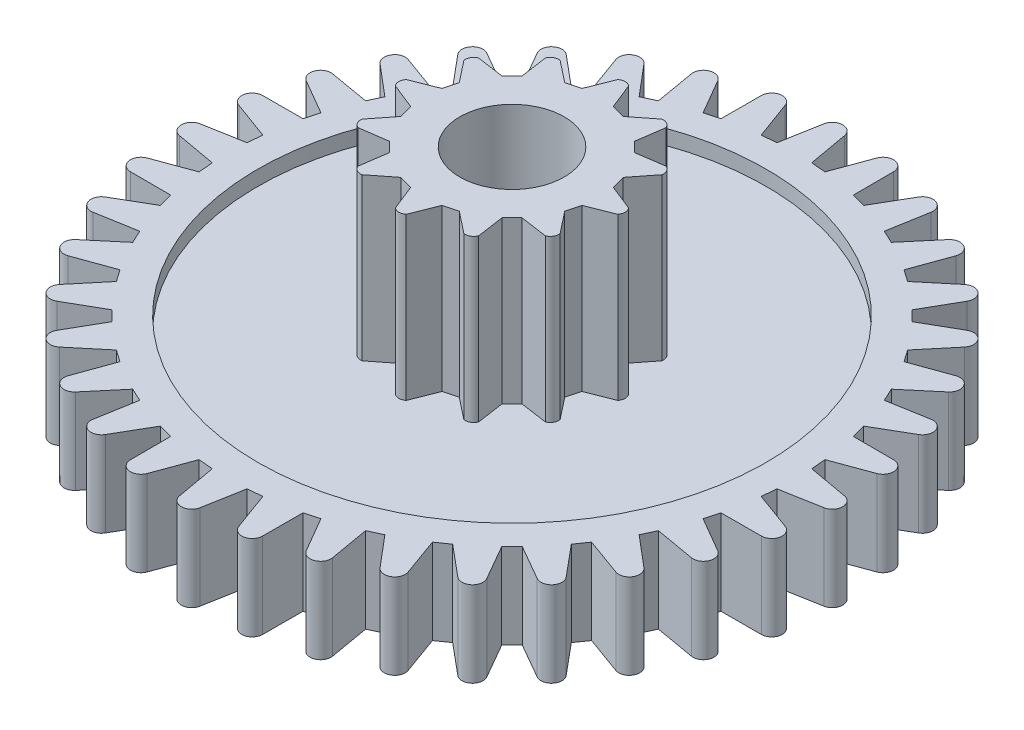
from build123d import *

# Parameters (mm, degrees)
SKETCH2_R          = 13.435028843
CUT_EXTRUDE1_DEPTH = 2.45
SKETCH3_R          = 4.596194078
CUT_EXTRUDE2_DEPTH = 4.63


with BuildPart() as part:
    # Sketch1 → Revolve1 (revolve)
    with BuildSketch(Plane.XY, mode=Mode.PRIVATE) as revolve1_sk:
        Polygon((3.25, 0.795), (7.3, 0.795), (7.3, 1.225), (9.5, 1.225), (9.5, -1.225), (7.3, -1.225), (7.3, -0.795), (2.5, -0.795), (2.5, -1.225), (1.5, -1.225), (1.5, 5.425), (3.25, 5.425), align=None)
    revolve(revolve1_sk.sketch.rotate(Axis((0, 5.425, 0), (0, -1, 0)), 90), axis=Axis((0, 5.425, 0), (0, -1, 0)))

    # Sketch2 → Cut-Extrude1 (cut)
    with BuildSketch(Plane(origin=(0, 1.225, 0), x_dir=(1, 0, 0), z_dir=(0, 1, 0))):
        Circle(SKETCH2_R)
        with BuildLine():
            Line((-0.295304093, 9.252872421), (-0.5, 8.109600792))
            Line((-0.5, 8.109600792), (-0.915813523, 8.073221822))
            Line((-0.915813523, 8.073221822), (-1.315926674, 9.163579516))
            ThreePointArc((-1.315926674, 9.163579516), (-1.649657688, 9.355673654), (-1.897562194, 9.061021481))
            Line((-1.897562194, 9.061021481), (-1.900621276, 7.899573645))
            Line((-1.900621276, 7.899573645), (-2.303800515, 7.791542093))
            Line((-2.303800515, 7.791542093), (-2.887173675, 8.795855883))
            ThreePointArc((-2.887173675, 8.795855883), (-3.249191362, 8.927079897), (-3.442163828, 8.593855987))
            Line((-3.442163828, 8.593855987), (-3.243493135, 7.44952195))
            Line((-3.243493135, 7.44952195), (-3.621787694, 7.2731203))
            Line((-3.621787694, 7.2731203), (-4.370695365, 8.160874621))
            ThreePointArc((-4.370695365, 8.160874621), (-4.75, 8.227241336), (-4.882177057, 7.865570529))
            Line((-4.882177057, 7.865570529), (-4.487813098, 6.7731203))
            Line((-4.487813098, 6.7731203), (-4.829728687, 6.533708427))
            Line((-4.829728687, 6.533708427), (-5.721415687, 7.277929313))
            ThreePointArc((-5.721415687, 7.277929313), (-6.106482292, 7.27742221), (-6.173847806, 6.898293689))
            Line((-6.173847806, 6.898293689), (-5.59577313, 5.890920818))
            Line((-5.59577313, 5.890920818), (-5.890920818, 5.59577313))
            Line((-5.890920818, 5.59577313), (-6.898293689, 6.173847806))
            ThreePointArc((-6.898293689, 6.173847806), (-7.27742221, 6.106482292), (-7.277929313, 5.721415687))
            Line((-7.277929313, 5.721415687), (-6.533708427, 4.829728687))
            Line((-6.533708427, 4.829728687), (-6.7731203, 4.487813098))
            Line((-6.7731203, 4.487813098), (-7.865570529, 4.882177057))
            ThreePointArc((-7.865570529, 4.882177057), (-8.227241336, 4.75), (-8.160874621, 4.370695365))
            Line((-8.160874621, 4.370695365), (-7.2731203, 3.621787694))
            Line((-7.2731203, 3.621787694), (-7.44952195, 3.243493135))
            Line((-7.44952195, 3.243493135), (-8.593855987, 3.442163828))
            ThreePointArc((-8.593855987, 3.442163828), (-8.927079897, 3.249191362), (-8.795855883, 2.887173675))
            Line((-8.795855883, 2.887173675), (-7.791542093, 2.303800515))
            Line((-7.791542093, 2.303800515), (-7.899573645, 1.900621276))
            Line((-7.899573645, 1.900621276), (-9.061021481, 1.897562194))
            ThreePointArc((-9.061021481, 1.897562194), (-9.355673654, 1.649657688), (-9.163579516, 1.315926674))
            Line((-9.163579516, 1.315926674), (-8.073221822, 0.915813523))
            Line((-8.073221822, 0.915813523), (-8.109600792, 0.5))
            Line((-8.109600792, 0.5), (-9.252872421, 0.295304093))
            ThreePointArc((-9.252872421, 0.295304093), (-9.5, 0), (-9.252872421, -0.295304093))
            Line((-9.252872421, -0.295304093), (-8.109600792, -0.5))
            Line((-8.109600792, -0.5), (-8.073221822, -0.915813523))
            Line((-8.073221822, -0.915813523), (-9.163579516, -1.315926674))
            ThreePointArc((-9.163579516, -1.315926674), (-9.355673654, -1.649657688), (-9.061021481, -1.897562194))
            Line((-9.061021481, -1.897562194), (-7.899573645, -1.900621276))
            Line((-7.899573645, -1.900621276), (-7.791542093, -2.303800515))
            Line((-7.791542093, -2.303800515), (-8.795855883, -2.887173675))
            ThreePointArc((-8.795855883, -2.887173675), (-8.927079897, -3.249191362), (-8.593855987, -3.442163828))
            Line((-8.593855987, -3.442163828), (-7.44952195, -3.243493135))
            Line((-7.44952195, -3.243493135), (-7.2731203, -3.621787694))
            Line((-7.2731203, -3.621787694), (-8.160874621, -4.370695365))
            ThreePointArc((-8.160874621, -4.370695365), (-8.227241336, -4.75), (-7.865570529, -4.882177057))
            Line((-7.865570529, -4.882177057), (-6.7731203, -4.487813098))
            Line((-6.7731203, -4.487813098), (-6.533708427, -4.829728687))
            Line((-6.533708427, -4.829728687), (-7.277929313, -5.721415687))
            ThreePointArc((-7.277929313, -5.721415687), (-7.27742221, -6.106482292), (-6.898293689, -6.173847806))
            Line((-6.898293689, -6.173847806), (-5.890920818, -5.59577313))
            Line((-5.890920818, -5.59577313), (-5.59577313, -5.890920818))
            Line((-5.59577313, -5.890920818), (-6.173847806, -6.898293689))
            ThreePointArc((-6.173847806, -6.898293689), (-6.106482292, -7.27742221), (-5.721415687, -7.277929313))
            Line((-5.721415687, -7.277929313), (-4.829728687, -6.533708427))
            Line((-4.829728687, -6.533708427), (-4.487813098, -6.7731203))
            Line((-4.487813098, -6.7731203), (-4.882177057, -7.865570529))
            ThreePointArc((-4.882177057, -7.865570529), (-4.75, -8.227241336), (-4.370695365, -8.160874621))
            Line((-4.370695365, -8.160874621), (-3.621787694, -7.2731203))
            Line((-3.621787694, -7.2731203), (-3.243493135, -7.44952195))
            Line((-3.243493135, -7.44952195), (-3.442163828, -8.593855987))
            ThreePointArc((-3.442163828, -8.593855987), (-3.249191362, -8.927079897), (-2.887173675, -8.795855883))
            Line((-2.887173675, -8.795855883), (-2.303800515, -7.791542093))
            Line((-2.303800515, -7.791542093), (-1.900621276, -7.899573645))
            Line((-1.900621276, -7.899573645), (-1.897562194, -9.061021481))
            ThreePointArc((-1.897562194, -9.061021481), (-1.649657688, -9.355673654), (-1.315926674, -9.163579516))
            Line((-1.315926674, -9.163579516), (-0.915813523, -8.073221822))
            Line((-0.915813523, -8.073221822), (-0.5, -8.109600792))
            Line((-0.5, -8.109600792), (-0.295304093, -9.252872421))
            ThreePointArc((-0.295304093, -9.252872421), (0, -9.5), (0.295304093, -9.252872421))
            Line((0.295304093, -9.252872421), (0.5, -8.109600792))
            Line((0.5, -8.109600792), (0.915813523, -8.073221822))
            Line((0.915813523, -8.073221822), (1.315926674, -9.163579516))
            ThreePointArc((1.315926674, -9.163579516), (1.649657688, -9.355673654), (1.897562194, -9.061021481))
            Line((1.897562194, -9.061021481), (1.900621276, -7.899573645))
            Line((1.900621276, -7.899573645), (2.303800515, -7.791542093))
            Line((2.303800515, -7.791542093), (2.887173675, -8.795855883))
            ThreePointArc((2.887173675, -8.795855883), (3.249191362, -8.927079897), (3.442163828, -8.593855987))
            Line((3.442163828, -8.593855987), (3.243493135, -7.44952195))
            Line((3.243493135, -7.44952195), (3.621787694, -7.2731203))
            Line((3.621787694, -7.2731203), (4.370695365, -8.160874621))
            ThreePointArc((4.370695365, -8.160874621), (4.75, -8.227241336), (4.882177057, -7.865570529))
            Line((4.882177057, -7.865570529), (4.487813098, -6.7731203))
            Line((4.487813098, -6.7731203), (4.829728687, -6.533708427))
            Line((4.829728687, -6.533708427), (5.721415687, -7.277929313))
            ThreePointArc((5.721415687, -7.277929313), (6.106482292, -7.27742221), (6.173847806, -6.898293689))
            Line((6.173847806, -6.898293689), (5.59577313, -5.890920818))
            Line((5.59577313, -5.890920818), (5.890920818, -5.59577313))
            Line((5.890920818, -5.59577313), (6.898293689, -6.173847806))
            ThreePointArc((6.898293689, -6.173847806), (7.27742221, -6.106482292), (7.277929313, -5.721415687))
            Line((7.277929313, -5.721415687), (6.533708427, -4.829728687))
            Line((6.533708427, -4.829728687), (6.7731203, -4.487813098))
            Line((6.7731203, -4.487813098), (7.865570529, -4.882177057))
            ThreePointArc((7.865570529, -4.882177057), (8.227241336, -4.75), (8.160874621, -4.370695365))
            Line((8.160874621, -4.370695365), (7.2731203, -3.621787694))
            Line((7.2731203, -3.621787694), (7.44952195, -3.243493135))
            Line((7.44952195, -3.243493135), (8.593855987, -3.442163828))
            ThreePointArc((8.593855987, -3.442163828), (8.927079897, -3.249191362), (8.795855883, -2.887173675))
            Line((8.795855883, -2.887173675), (7.791542093, -2.303800515))
            Line((7.791542093, -2.303800515), (7.899573645, -1.900621276))
            Line((7.899573645, -1.900621276), (9.061021481, -1.897562194))
            ThreePointArc((9.061021481, -1.897562194), (9.355673654, -1.649657688), (9.163579516, -1.315926674))
            Line((9.163579516, -1.315926674), (8.073221822, -0.915813523))
            Line((8.073221822, -0.915813523), (8.109600792, -0.5))
            Line((8.109600792, -0.5), (9.252872421, -0.295304093))
            ThreePointArc((9.252872421, -0.295304093), (9.5, 0), (9.252872421, 0.295304093))
            Line((9.252872421, 0.295304093), (8.109600792, 0.5))
            Line((8.109600792, 0.5), (8.073221822, 0.915813523))
            Line((8.073221822, 0.915813523), (9.163579516, 1.315926674))
            ThreePointArc((9.163579516, 1.315926674), (9.355673654, 1.649657688), (9.061021481, 1.897562194))
            Line((9.061021481, 1.897562194), (7.899573645, 1.900621276))
            Line((7.899573645, 1.900621276), (7.791542093, 2.303800515))
            Line((7.791542093, 2.303800515), (8.795855883, 2.887173675))
            ThreePointArc((8.795855883, 2.887173675), (8.927079897, 3.249191362), (8.593855987, 3.442163828))
            Line((8.593855987, 3.442163828), (7.44952195, 3.243493135))
            Line((7.44952195, 3.243493135), (7.2731203, 3.621787694))
            Line((7.2731203, 3.621787694), (8.160874621, 4.370695365))
            ThreePointArc((8.160874621, 4.370695365), (8.227241336, 4.75), (7.865570529, 4.882177057))
            Line((7.865570529, 4.882177057), (6.7731203, 4.487813098))
            Line((6.7731203, 4.487813098), (6.533708427, 4.829728687))
            Line((6.533708427, 4.829728687), (7.277929313, 5.721415687))
            ThreePointArc((7.277929313, 5.721415687), (7.27742221, 6.106482292), (6.898293689, 6.173847806))
            Line((6.898293689, 6.173847806), (5.890920818, 5.59577313))
            Line((5.890920818, 5.59577313), (5.59577313, 5.890920818))
            Line((5.59577313, 5.890920818), (6.173847806, 6.898293689))
            ThreePointArc((6.173847806, 6.898293689), (6.106482292, 7.27742221), (5.721415687, 7.277929313))
            Line((5.721415687, 7.277929313), (4.829728687, 6.533708427))
            Line((4.829728687, 6.533708427), (4.487813098, 6.7731203))
            Line((4.487813098, 6.7731203), (4.882177057, 7.865570529))
            ThreePointArc((4.882177057, 7.865570529), (4.75, 8.227241336), (4.370695365, 8.160874621))
            Line((4.370695365, 8.160874621), (3.621787694, 7.2731203))
            Line((3.621787694, 7.2731203), (3.243493135, 7.44952195))
            Line((3.243493135, 7.44952195), (3.442163828, 8.593855987))
            ThreePointArc((3.442163828, 8.593855987), (3.249191362, 8.927079897), (2.887173675, 8.795855883))
            Line((2.887173675, 8.795855883), (2.303800515, 7.791542093))
            Line((2.303800515, 7.791542093), (1.900621276, 7.899573645))
            Line((1.900621276, 7.899573645), (1.897562194, 9.061021481))
            ThreePointArc((1.897562194, 9.061021481), (1.649657688, 9.355673654), (1.315926674, 9.163579516))
            Line((1.315926674, 9.163579516), (0.915813523, 8.073221822))
            Line((0.915813523, 8.073221822), (0.5, 8.109600792))
            Line((0.5, 8.109600792), (0.295304093, 9.252872421))
            ThreePointArc((0.295304093, 9.252872421), (0, 9.5), (-0.295304093, 9.252872421))
        make_face(mode=Mode.SUBTRACT)
    extrude(amount=-CUT_EXTRUDE1_DEPTH, mode=Mode.SUBTRACT)

    # Sketch3 → Cut-Extrude2 (cut)
    with BuildSketch(Plane(origin=(0, 5.425, 0), x_dir=(1, 0, 0), z_dir=(0, 1, 0))):
        Circle(SKETCH3_R)
        with BuildLine():
            Line((-0.45, 2.459166525), (-0.155651272, 3.19563405))
            ThreePointArc((-0.155651272, 3.19563405), (0, 3.25), (0.155651272, 3.19563405))
            Line((0.155651272, 3.19563405), (0.45, 2.459166525))
            Line((0.45, 2.459166525), (0.839871831, 2.354700683))
            Line((0.839871831, 2.354700683), (1.463019069, 2.845325904))
            ThreePointArc((1.463019069, 2.845325904), (1.625, 2.814582562), (1.732614981, 2.689674632))
            Line((1.732614981, 2.689674632), (1.619294694, 1.904700683))
            Line((1.619294694, 1.904700683), (1.904700683, 1.619294694))
            Line((1.904700683, 1.619294694), (2.689674632, 1.732614981))
            ThreePointArc((2.689674632, 1.732614981), (2.814582562, 1.625), (2.845325904, 1.463019069))
            Line((2.845325904, 1.463019069), (2.354700683, 0.839871831))
            Line((2.354700683, 0.839871831), (2.459166525, 0.45))
            Line((2.459166525, 0.45), (3.19563405, 0.155651272))
            ThreePointArc((3.19563405, 0.155651272), (3.25, 0), (3.19563405, -0.155651272))
            Line((3.19563405, -0.155651272), (2.459166525, -0.45))
            Line((2.459166525, -0.45), (2.354700683, -0.839871831))
            Line((2.354700683, -0.839871831), (2.845325904, -1.463019069))
            ThreePointArc((2.845325904, -1.463019069), (2.814582562, -1.625), (2.689674632, -1.732614981))
            Line((2.689674632, -1.732614981), (1.904700683, -1.619294694))
            Line((1.904700683, -1.619294694), (1.619294694, -1.904700683))
            Line((1.619294694, -1.904700683), (1.732614981, -2.689674632))
            ThreePointArc((1.732614981, -2.689674632), (1.625, -2.814582562), (1.463019069, -2.845325904))
            Line((1.463019069, -2.845325904), (0.839871831, -2.354700683))
            Line((0.839871831, -2.354700683), (0.45, -2.459166525))
            Line((0.45, -2.459166525), (0.155651272, -3.19563405))
            ThreePointArc((0.155651272, -3.19563405), (0, -3.25), (-0.155651272, -3.19563405))
            Line((-0.155651272, -3.19563405), (-0.45, -2.459166525))
            Line((-0.45, -2.459166525), (-0.839871831, -2.354700683))
            Line((-0.839871831, -2.354700683), (-1.463019069, -2.845325904))
            ThreePointArc((-1.463019069, -2.845325904), (-1.625, -2.814582562), (-1.732614981, -2.689674632))
            Line((-1.732614981, -2.689674632), (-1.619294694, -1.904700683))
            Line((-1.619294694, -1.904700683), (-1.904700683, -1.619294694))
            Line((-1.904700683, -1.619294694), (-2.689674632, -1.732614981))
            ThreePointArc((-2.689674632, -1.732614981), (-2.814582562, -1.625), (-2.845325904, -1.463019069))
            Line((-2.845325904, -1.463019069), (-2.354700683, -0.839871831))
            Line((-2.354700683, -0.839871831), (-2.459166525, -0.45))
            Line((-2.459166525, -0.45), (-3.19563405, -0.155651272))
            ThreePointArc((-3.19563405, -0.155651272), (-3.25, 0), (-3.19563405, 0.155651272))
            Line((-3.19563405, 0.155651272), (-2.459166525, 0.45))
            Line((-2.459166525, 0.45), (-2.354700683, 0.839871831))
            Line((-2.354700683, 0.839871831), (-2.845325904, 1.463019069))
            ThreePointArc((-2.845325904, 1.463019069), (-2.814582562, 1.625), (-2.689674632, 1.732614981))
            Line((-2.689674632, 1.732614981), (-1.904700683, 1.619294694))
            Line((-1.904700683, 1.619294694), (-1.619294694, 1.904700683))
            Line((-1.619294694, 1.904700683), (-1.732614981, 2.689674632))
            ThreePointArc((-1.732614981, 2.689674632), (-1.625, 2.814582562), (-1.463019069, 2.845325904))
            Line((-1.463019069, 2.845325904), (-0.839871831, 2.354700683))
            Line((-0.839871831, 2.354700683), (-0.45, 2.459166525))
        make_face(mode=Mode.SUBTRACT)
    extrude(amount=-CUT_EXTRUDE2_DEPTH, mode=Mode.SUBTRACT)


solid = part.part
